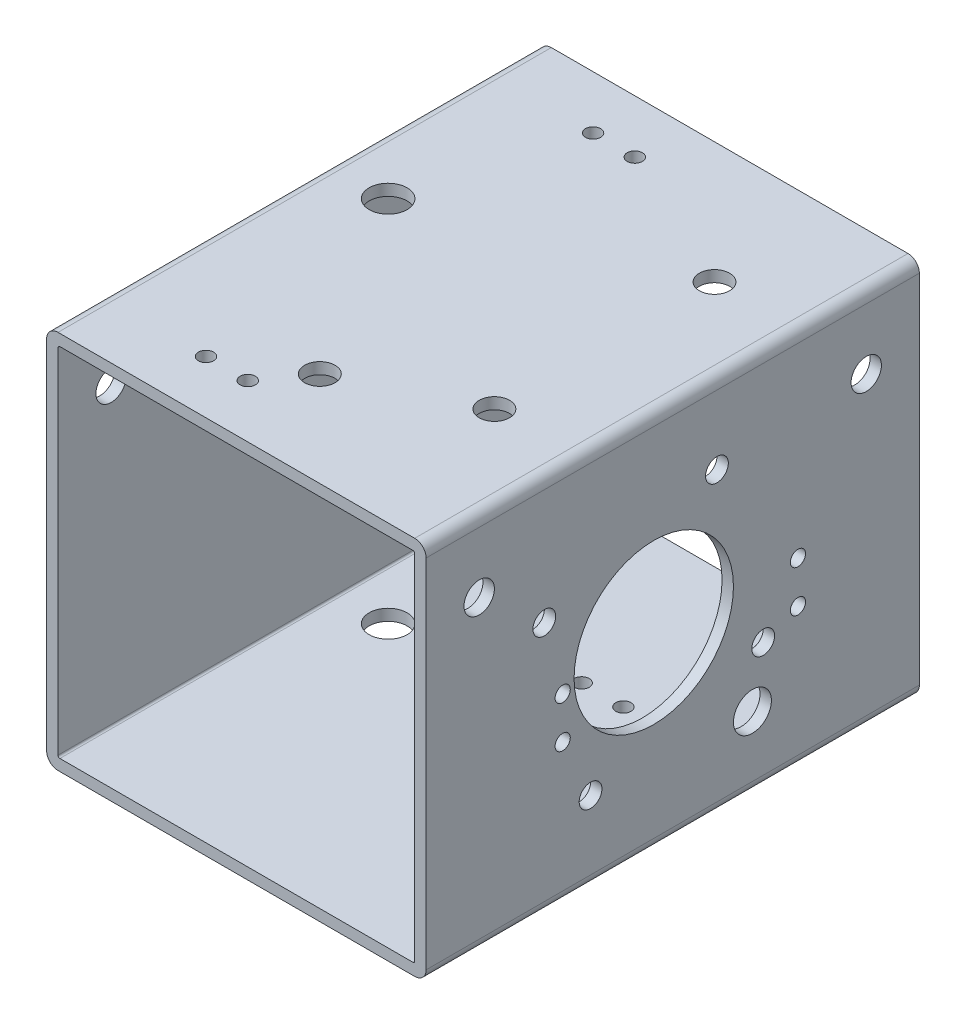
from build123d import *

# Parameters (mm, degrees)
SKETCH1_W                      = 100
SKETCH1_H                      = 100
SKETCH1_W_2                    = 94
SKETCH1_H_2                    = 94
EXTRUDE_THIN1_DEPTH            = 130
FILLET1_R                      = 0.5
FILLET2_R                      = 3
F_8_0_8_DIAMETER_HOLE2_D       = 8
F_8_0_8_DIAMETER_HOLE3_D       = 8
F_10_0_10_DIAMETER_HOLE1_D     = 10
F_10_0_10_DIAMETER_HOLE2_D     = 10
F_21_0_21_DIAMETER_HOLE1_D     = 42
F_21_0_21_DIAMETER_HOLE1_DEPTH = 3
F_6_0_6_DIAMETER_HOLE1_D       = 6
F_6_0_6_DIAMETER_HOLE1_DEPTH   = 3
SKETCH33_R                     = 4
CUT_EXTRUDE1_DEPTH             = 10
SKETCH34_R                     = 2
CUT_EXTRUDE2_DEPTH             = 10
SKETCH35_R                     = 2
CUT_EXTRUDE3_DEPTH             = 10
SKETCH36_R                     = 2
CUT_EXTRUDE4_DEPTH             = 10
SKETCH37_R                     = 2
CUT_EXTRUDE5_DEPTH             = 10
CUT_EXTRUDE6_REACH             = 173.464
SKETCH38_R                     = 3.1
CUT_EXTRUDE7_REACH             = 173.464
SKETCH39_R                     = 3.1


with BuildPart() as part:
    # Sketch1 → Extrude-Thin1 (new body)
    with BuildSketch(Plane.XY):
        Rectangle(SKETCH1_W, SKETCH1_H)
        Rectangle(SKETCH1_W_2, SKETCH1_H_2, mode=Mode.SUBTRACT)
    extrude(amount=EXTRUDE_THIN1_DEPTH)

    # Fillet1
    fillet1_edges = [part.edges().sort_by_distance(p)[0] for p in [
        (47, -47, 65),
        (47, 47, 65),
        (-47, 47, 65),
        (-47, -47, 65),
    ]]
    fillet(fillet1_edges, radius=FILLET1_R)

    # Fillet2
    fillet2_edges = [part.edges().sort_by_distance(p)[0] for p in [
        (50, -50, 65),
        (-50, -50, 65),
        (-50, 50, 65),
        (50, 50, 65),
    ]]
    fillet(fillet2_edges, radius=FILLET2_R)

    # Ø8.0 (8) Diameter Hole2 (through all)
    with Locations(Plane(origin=(0, 50, 0), x_dir=(1, 0, 0), z_dir=(0, 1, 0))):
        with Locations((28, -32), (28, -90)):
            Hole(F_8_0_8_DIAMETER_HOLE2_D / 2)

    # Ø8.0 (8) Diameter Hole3 (through all)
    with Locations(Plane(origin=(50, 0, 0), x_dir=(0, 0, -1), z_dir=(1, 0, 0))):
        with Locations((-14, 31), (-116, 31)):
            Hole(F_8_0_8_DIAMETER_HOLE3_D / 2)

    # Ø10.0 (10) Diameter Hole1 (through all)
    with Locations(Plane(origin=(0, 50, 0), x_dir=(1, 0, 0), z_dir=(0, 1, 0))):
        with Locations((-34, -56)):
            Hole(F_10_0_10_DIAMETER_HOLE1_D / 2)

    # Ø10.0 (10) Diameter Hole2 (through all)
    with Locations(Plane(origin=(50, 0, 0), x_dir=(0, 0, -1), z_dir=(1, 0, 0))):
        with Locations((-44, -31)):
            Hole(F_10_0_10_DIAMETER_HOLE2_D / 2)

    # Ø21.0 (21) Diameter Hole1
    with Locations(Plane(origin=(50, 0, 0), x_dir=(0, 0, -1), z_dir=(1, 0, 0))):
        with Locations((-70, 0)):
            Hole(F_21_0_21_DIAMETER_HOLE1_D / 2, depth=F_21_0_21_DIAMETER_HOLE1_DEPTH)

    # Ø6.0 (6) Diameter Hole1
    with Locations(Plane(origin=(50, 0, 0), x_dir=(0, 0, -1), z_dir=(1, 0, 0))):
        with Locations((-41.157258279, -16.652364697), (-53.347635303, 28.842741721), (-98.842741721, 16.652364697), (-86.652364697, -28.842741721)):
            Hole(F_6_0_6_DIAMETER_HOLE1_D / 2, depth=F_6_0_6_DIAMETER_HOLE1_DEPTH)

    # Sketch33 → Cut-Extrude1 (cut)
    with BuildSketch(Plane(origin=(0, 50, 0), x_dir=(1, 0, 0), z_dir=(0, 1, 0))):
        with Locations(Location((-3, -105, 0), (0, 0, 270))):
            Circle(SKETCH33_R)
    extrude(amount=-CUT_EXTRUDE1_DEPTH, mode=Mode.SUBTRACT)

    # Sketch34 → Cut-Extrude2 (cut)
    with BuildSketch(Plane(origin=(0, 50, 0), x_dir=(1, 0, 0), z_dir=(0, 1, 0))):
        with Locations(Location((-22, -14, 0), (0, 0, 270))):
            Circle(SKETCH34_R)
        with Locations(Location((-11, -14, 0), (0, 0, 270))):
            Circle(SKETCH34_R)
        with Locations(Location((-11, -116, 0), (0, 0, 90))):
            Circle(SKETCH34_R)
        with Locations(Location((-22, -116, 0), (0, 0, 90))):
            Circle(SKETCH34_R)
    extrude(amount=-CUT_EXTRUDE2_DEPTH, mode=Mode.SUBTRACT)

    # Sketch35 → Cut-Extrude3 (cut)
    with BuildSketch(Plane.ZY.offset(50)):
        with Locations(Location((56, 19, 0), (0, 0, 270))):
            Circle(SKETCH35_R)
        with Locations(Location((56, 8, 0), (0, 0, 270))):
            Circle(SKETCH35_R)
    extrude(amount=-CUT_EXTRUDE3_DEPTH, mode=Mode.SUBTRACT)

    # Sketch36 → Cut-Extrude4 (cut)
    with BuildSketch(Plane.XZ.offset(50)):
        with Locations(Location((16, 44, 0), (0, 0, 270))):
            Circle(SKETCH36_R)
        with Locations(Location((5, 44, 0), (0, 0, 270))):
            Circle(SKETCH36_R)
    extrude(amount=-CUT_EXTRUDE4_DEPTH, mode=Mode.SUBTRACT)

    # Sketch37 → Cut-Extrude5 (cut)
    with BuildSketch(Plane(origin=(50, 0, 0), x_dir=(0, 0, -1), z_dir=(1, 0, 0))):
        with Locations(Location((-32, -13, 0), (0, 0, 90))):
            Circle(SKETCH37_R)
        with Locations(Location((-32, -2, 0), (0, 0, 90))):
            Circle(SKETCH37_R)
        with Locations(Location((-94, -13, 0), (0, 0, 90))):
            Circle(SKETCH37_R)
        with Locations(Location((-94, -2, 0), (0, 0, 90))):
            Circle(SKETCH37_R)
    extrude(amount=-CUT_EXTRUDE5_DEPTH, mode=Mode.SUBTRACT)

    # Sketch38 → Cut-Extrude6 (cut, up to next)
    with BuildSketch(Plane.ZY.offset(50), mode=Mode.PRIVATE) as cut_extrude6_sk1:
        with Locations(Location((56, 35, 0), (0, 0, 270))):
            Circle(SKETCH38_R)
    cut_extrude6_tool1 = extrude(cut_extrude6_sk1.sketch, amount=-CUT_EXTRUDE6_REACH, mode=Mode.PRIVATE) & part.part
    # Sketch38 → Cut-Extrude6 (cut, up to next)
    with BuildSketch(Plane.ZY.offset(50), mode=Mode.PRIVATE) as cut_extrude6_sk2:
        with Locations(Location((56, -15, 0), (0, 0, 270))):
            Circle(SKETCH38_R)
    cut_extrude6_tool2 = extrude(cut_extrude6_sk2.sketch, amount=-CUT_EXTRUDE6_REACH, mode=Mode.PRIVATE) & part.part
    add(cut_extrude6_tool1.solids().sort_by_distance((-50, 35, 56))[0], mode=Mode.SUBTRACT)
    add(cut_extrude6_tool2.solids().sort_by_distance((-50, -15, 56))[0], mode=Mode.SUBTRACT)

    # Sketch39 → Cut-Extrude7 (cut, up to next)
    with BuildSketch(Plane.XZ.offset(50), mode=Mode.PRIVATE) as cut_extrude7_sk1:
        with Locations(Location((-20, 44, 0), (0, 0, 270))):
            Circle(SKETCH39_R)
    cut_extrude7_tool1 = extrude(cut_extrude7_sk1.sketch, amount=-CUT_EXTRUDE7_REACH, mode=Mode.PRIVATE) & part.part
    # Sketch39 → Cut-Extrude7 (cut, up to next)
    with BuildSketch(Plane.XZ.offset(50), mode=Mode.PRIVATE) as cut_extrude7_sk2:
        with Locations(Location((38, 44, 0), (0, 0, 270))):
            Circle(SKETCH39_R)
    cut_extrude7_tool2 = extrude(cut_extrude7_sk2.sketch, amount=-CUT_EXTRUDE7_REACH, mode=Mode.PRIVATE) & part.part
    add(cut_extrude7_tool1.solids().sort_by_distance((-20, -50, 44))[0], mode=Mode.SUBTRACT)
    add(cut_extrude7_tool2.solids().sort_by_distance((38, -50, 44))[0], mode=Mode.SUBTRACT)


solid = part.part
